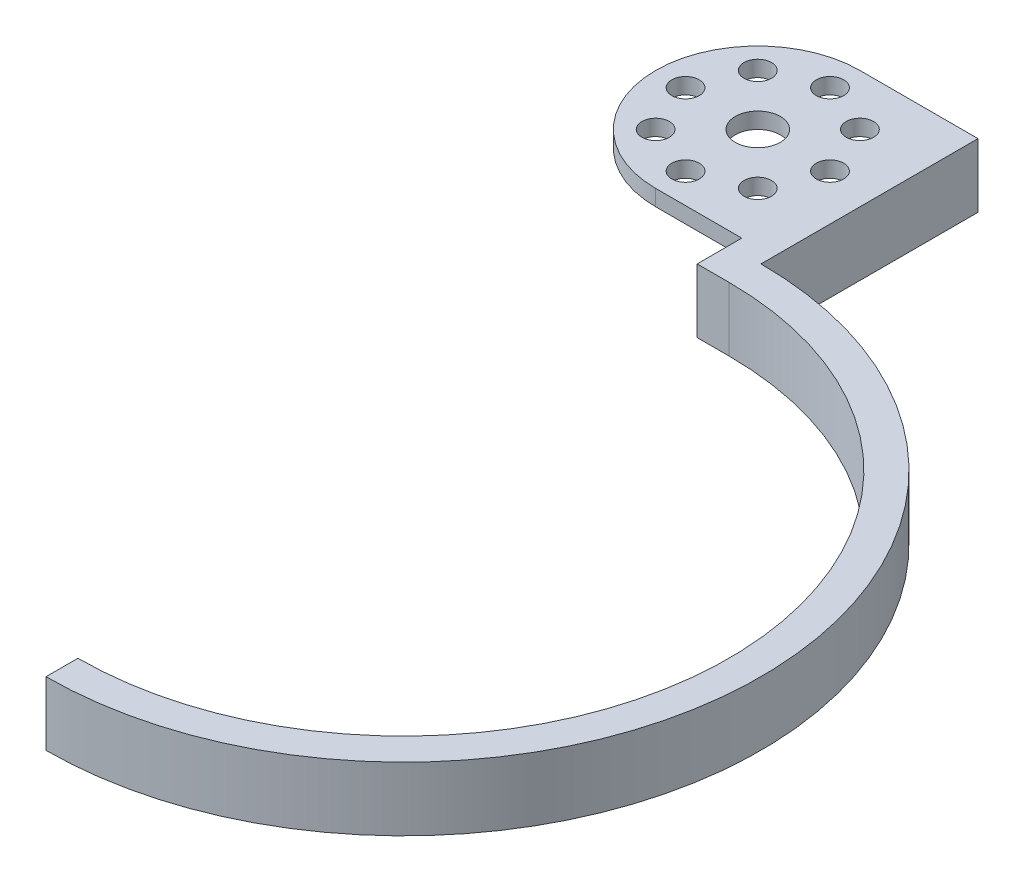
from build123d import *

# Parameters (mm, degrees)
SKETCH4_W                = 18.5
SKETCH4_H                = 32
BOSS_EXTRUDE2_DEPTH      = 2.5
SKETCH5_R                = 16
BOSS_EXTRUDE3_DEPTH      = 2.5
BOSS_EXTRUDE4_DEPTH      = 2.5
BOSS_EXTRUDE4_DEPTH_BACK = 7.5
SKETCH6_W                = 5
SKETCH6_H                = 7
SKETCH9_R                = 2.15
CUT_EXTRUDE1_DEPTH       = 2.5
SKETCH9_3_R              = 3.525
CUT_EXTRUDE3_DEPTH       = 2.5
BOSS_EXTRUDE7_DEPTH      = 10
SKETCH16_W               = 5
SKETCH16_H               = 32
BOSS_EXTRUDE8_DEPTH      = 7.5


with BuildPart() as part:
    # Sketch4 → Boss-Extrude2 (new body)
    with BuildSketch(Plane(origin=(0, 0, 0), x_dir=(1, 0, 0), z_dir=(0, 1, 0))):
        with Locations((11.010130113, -46.927053824)):
            Rectangle(SKETCH4_W, SKETCH4_H)
    extrude(amount=BOSS_EXTRUDE2_DEPTH)

    # Sketch5 → Boss-Extrude3 (add)
    with BuildSketch(Plane(origin=(0, 0, 0), x_dir=(1, 0, 0), z_dir=(0, 1, 0))):
        with Locations((1.760130113, -46.927053824)):
            Circle(SKETCH5_R)
    extrude(amount=BOSS_EXTRUDE3_DEPTH)

    # Sketch6 → Boss-Extrude4 (add, two sides: drawn at the far end of the back side and taken through both)
    with BuildSketch(Plane(origin=(0, 0, 0), x_dir=(1, 0, 0), z_dir=(0, 1, 0)).offset(-BOSS_EXTRUDE4_DEPTH_BACK)):
        with Locations((17.760130113, -66.427053824)):
            Rectangle(SKETCH6_W, SKETCH6_H)
    extrude(amount=BOSS_EXTRUDE4_DEPTH + BOSS_EXTRUDE4_DEPTH_BACK)

    # Sketch9 → Cut-Extrude1 (cut)
    with BuildSketch(Plane(origin=(0, 0, 0), x_dir=(1, 0, 0), z_dir=(0, 1, 0))):
        with Locations((1.760130113, -35.613345325)):
            Circle(SKETCH9_R)
        with Locations((9.760130113, -38.927053824)):
            Circle(SKETCH9_R)
        with Locations((13.073838612, -46.927053824)):
            Circle(SKETCH9_R)
        with Locations((9.760130113, -54.927053824)):
            Circle(SKETCH9_R)
        with Locations((1.760130113, -58.240762323)):
            Circle(SKETCH9_R)
        with Locations((-6.239869887, -54.927053824)):
            Circle(SKETCH9_R)
        with Locations((-9.553578386, -46.927053824)):
            Circle(SKETCH9_R)
        with Locations((-6.239869887, -38.927053824)):
            Circle(SKETCH9_R)
    extrude(amount=CUT_EXTRUDE1_DEPTH, mode=Mode.SUBTRACT)

    # Sketch9<3> → Cut-Extrude3 (cut)
    with BuildSketch(Plane(origin=(0, 0, 0), x_dir=(1, 0, 0), z_dir=(0, 1, 0))):
        with Locations((1.760130113, -46.927053824)):
            Circle(SKETCH9_3_R)
    extrude(amount=CUT_EXTRUDE3_DEPTH, mode=Mode.SUBTRACT)

    # Sketch14 → Boss-Extrude7 (add)
    with BuildSketch(Plane(origin=(0, -7.5, 0), x_dir=(-1, 0, 0), z_dir=(0, -1, 0))):
        with BuildLine():
            Line((-20.260130113, -171.927053824), (-20.260130113, -176.927053824))
            ThreePointArc((-20.260130113, -176.927053824), (-76.260130113, -120.927053824), (-20.260130113, -64.927053824))
            Line((-20.260130113, -64.927053824), (-20.260130113, -69.927053824))
            ThreePointArc((-20.260130113, -69.927053824), (-71.260130113, -120.927053824), (-20.260130113, -171.927053824))
        make_face()
    extrude(amount=-BOSS_EXTRUDE7_DEPTH)

    # Sketch16 → Boss-Extrude8 (add)
    with BuildSketch(Plane(origin=(0, 0, 0), x_dir=(-1, 0, 0), z_dir=(0, -1, 0))):
        with Locations((-17.760130113, -46.927053824)):
            Rectangle(SKETCH16_W, SKETCH16_H)
    extrude(amount=BOSS_EXTRUDE8_DEPTH)


solid = part.part
